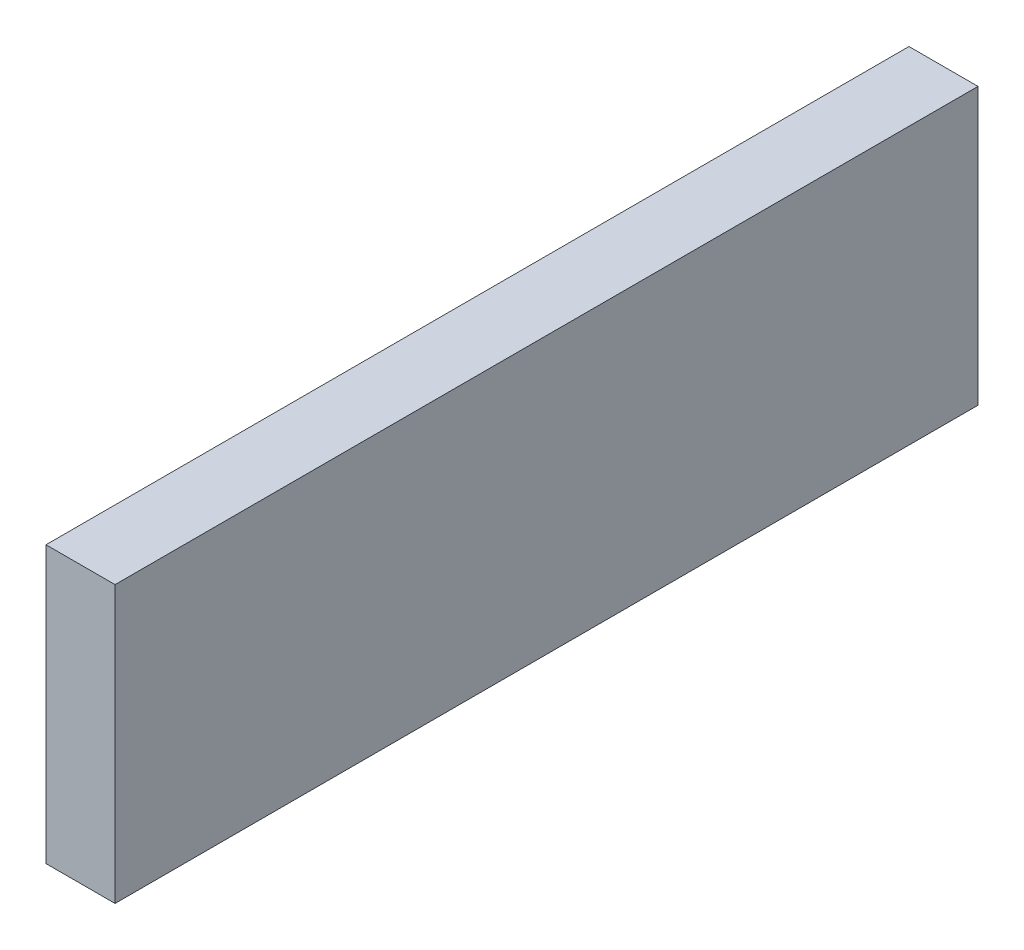
from build123d import *

# Parameters (mm, degrees)
SKETCH3_W           = 20
SKETCH3_H           = 80
BOSS_EXTRUDE1_DEPTH = 250


with BuildPart() as part:
    # Sketch3 → Boss-Extrude1 (new body)
    with BuildSketch(Plane.XY):
        Rectangle(SKETCH3_W, SKETCH3_H)
    extrude(amount=BOSS_EXTRUDE1_DEPTH)


solid = part.part
